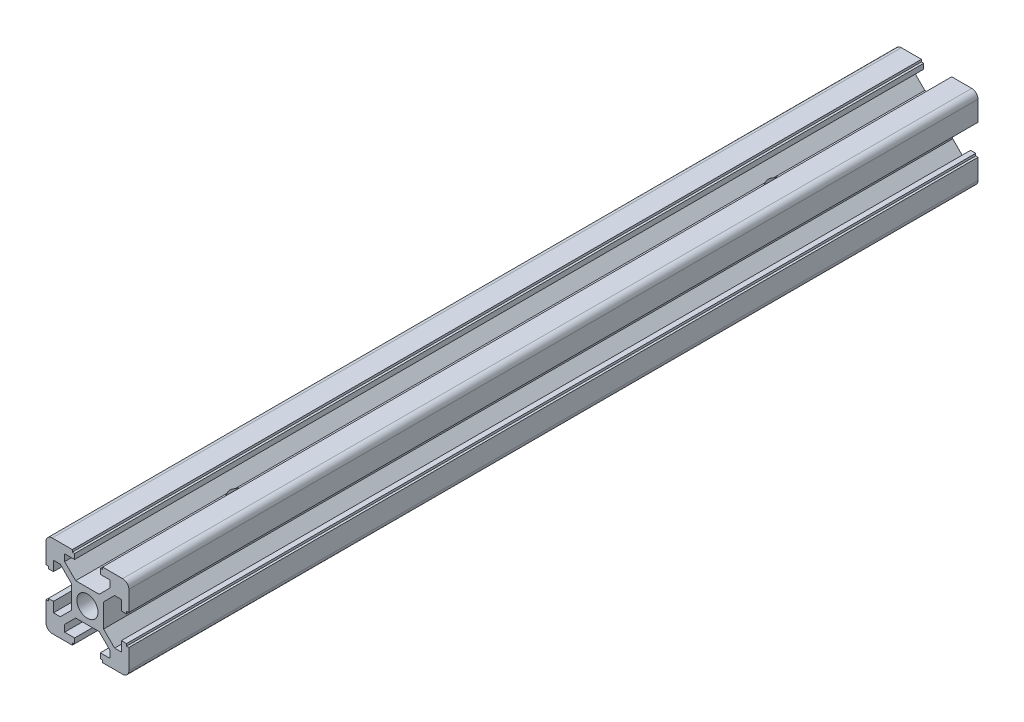
from build123d import *

# Parameters (mm, degrees)
SKETCH_2_R          = 2.55
EXTRUDE_1_DEPTH     = 205
SKETCH_3_R          = 3
CUT_EXTRUDE_1_DEPTH = 207.215906273


with BuildPart() as part:
    # 草图2 → 凸台-拉伸1 (new body)
    with BuildSketch(Plane.XY):
        with BuildLine():
            Line((-3.9, 2.839339828), (-6.560660172, 5.5))
            Line((-6.560660172, 5.5), (-8.2, 5.5))
            Line((-8.2, 5.5), (-8.2, 3.1))
            Line((-8.2, 3.1), (-9.45, 3.1))
            Line((-9.45, 3.1), (-9.45, 3.65))
            Line((-9.45, 3.65), (-10, 3.65))
            Line((-10, 3.65), (-10, 8.5))
            ThreePointArc((-10, 8.5), (-9.560660172, 9.560660172), (-8.5, 10))
            Line((-8.5, 10), (-3.65, 10))
            Line((-3.65, 10), (-3.65, 9.45))
            Line((-3.65, 9.45), (-3.1, 9.45))
            Line((-3.1, 9.45), (-3.1, 8.2))
            Line((-3.1, 8.2), (-5.5, 8.2))
            Line((-5.5, 8.2), (-5.5, 6.560660172))
            Line((-5.5, 6.560660172), (-2.839339828, 3.9))
            Line((-2.839339828, 3.9), (2.839339828, 3.9))
            Line((2.839339828, 3.9), (5.5, 6.560660172))
            Line((5.5, 6.560660172), (5.5, 8.2))
            Line((5.5, 8.2), (3.1, 8.2))
            Line((3.1, 8.2), (3.1, 9.45))
            Line((3.1, 9.45), (3.65, 9.45))
            Line((3.65, 9.45), (3.65, 10))
            Line((3.65, 10), (8.5, 10))
            ThreePointArc((8.5, 10), (9.560660172, 9.560660172), (10, 8.5))
            Line((10, 8.5), (10, 3.65))
            Line((10, 3.65), (9.45, 3.65))
            Line((9.45, 3.65), (9.45, 3.1))
            Line((9.45, 3.1), (8.2, 3.1))
            Line((8.2, 3.1), (8.2, 5.5))
            Line((8.2, 5.5), (6.560660172, 5.5))
            Line((6.560660172, 5.5), (3.9, 2.839339828))
            Line((3.9, 2.839339828), (3.9, -2.839339828))
            Line((3.9, -2.839339828), (6.560660172, -5.5))
            Line((6.560660172, -5.5), (8.2, -5.5))
            Line((8.2, -5.5), (8.2, -3.1))
            Line((8.2, -3.1), (9.45, -3.1))
            Line((9.45, -3.1), (9.45, -3.65))
            Line((9.45, -3.65), (10, -3.65))
            Line((10, -3.65), (10, -8.5))
            ThreePointArc((10, -8.5), (9.560660172, -9.560660172), (8.5, -10))
            Line((8.5, -10), (3.65, -10))
            Line((3.65, -10), (3.65, -9.45))
            Line((3.65, -9.45), (3.1, -9.45))
            Line((3.1, -9.45), (3.1, -8.2))
            Line((3.1, -8.2), (5.5, -8.2))
            Line((5.5, -8.2), (5.5, -6.560660172))
            Line((5.5, -6.560660172), (2.839339828, -3.9))
            Line((2.839339828, -3.9), (-2.839339828, -3.9))
            Line((-2.839339828, -3.9), (-5.5, -6.560660172))
            Line((-5.5, -6.560660172), (-5.5, -8.2))
            Line((-5.5, -8.2), (-3.1, -8.2))
            Line((-3.1, -8.2), (-3.1, -9.45))
            Line((-3.1, -9.45), (-3.65, -9.45))
            Line((-3.65, -9.45), (-3.65, -10))
            Line((-3.65, -10), (-8.5, -10))
            ThreePointArc((-8.5, -10), (-9.560660172, -9.560660172), (-10, -8.5))
            Line((-10, -8.5), (-10, -3.65))
            Line((-10, -3.65), (-9.45, -3.65))
            Line((-9.45, -3.65), (-9.45, -3.1))
            Line((-9.45, -3.1), (-8.2, -3.1))
            Line((-8.2, -3.1), (-8.2, -5.5))
            Line((-8.2, -5.5), (-6.560660172, -5.5))
            Line((-6.560660172, -5.5), (-3.9, -2.839339828))
            Line((-3.9, -2.839339828), (-3.9, 2.839339828))
        make_face()
        with Locations(Location((0, 0, 0), (0, 0, 180))):
            Circle(SKETCH_2_R, mode=Mode.SUBTRACT)
    extrude(amount=EXTRUDE_1_DEPTH)

    # 草图3 → 切除-拉伸1 (cut, through all)
    with BuildSketch(Plane.XZ.offset(10)):
        with Locations(Location((0, 167.5, 0), (0, 0, 198.835996158))):
            Circle(SKETCH_3_R)
        with Locations(Location((0, 37.5, 0), (0, 0, 198.835996158))):
            Circle(SKETCH_3_R)
    extrude(amount=-CUT_EXTRUDE_1_DEPTH, mode=Mode.SUBTRACT)


solid = part.part
